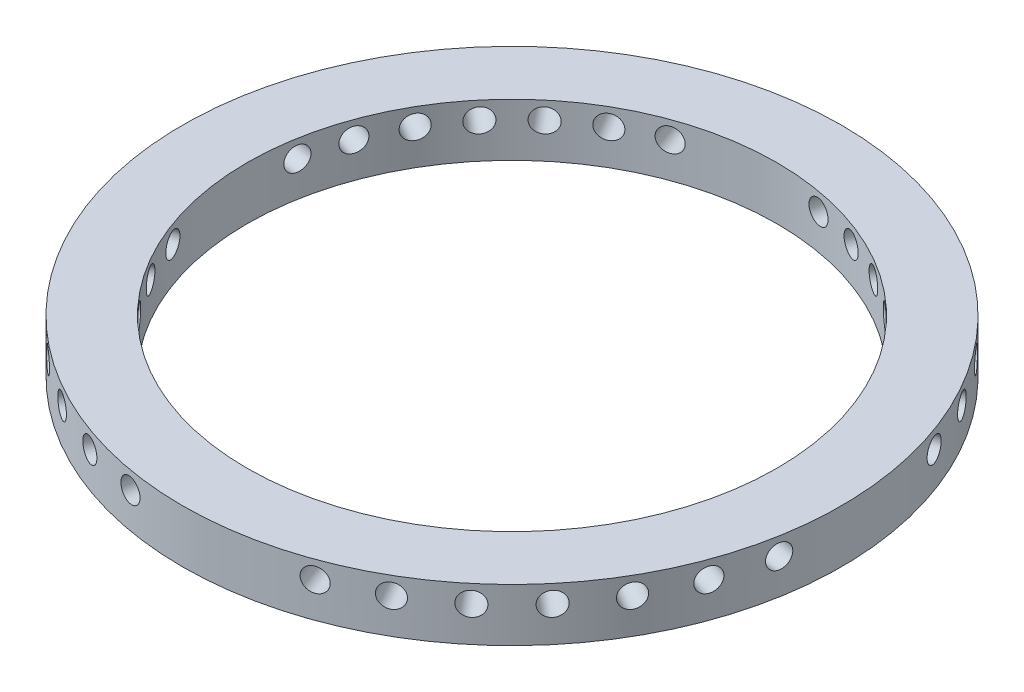
from build123d import *

# Parameters (mm, degrees)
CROQUIS2_R              = 1
CORTAR_EXTRUIR1_DEPTH   = 10
MATRIZC1_COUNT          = 36
CROQUIS3_R              = 1.8
CORTAR_EXTRUIR2_DEPTH   = 3.5
CROQUIS4_R              = 1.8
SALIENTE_EXTRUIR1_DEPTH = 4.5


with BuildPart() as part:
    # Croquis1 → Revolución1 (revolve)
    with BuildSketch(Plane.XY, mode=Mode.PRIVATE) as revoluci_n1_sk:
        Polygon((-22.5, 0), (-28, 0), (-28, 1), (-28, 4.5), (-22.5, 4.5), align=None)
    revolve(revoluci_n1_sk.sketch.rotate(Axis((0, 0, 0), (0, 1, 0)), 270), axis=Axis((0, 0, 0), (0, 1, 0)))

    # Croquis2 → Cortar-Extruir1 (cut)
    with BuildSketch(Plane.ZY.offset(28)):
        with Locations(Location((0, 3, 0), (0, 0, 270))):
            Circle(CROQUIS2_R)
    cortar_extruir1 = extrude(amount=-CORTAR_EXTRUIR1_DEPTH, mode=Mode.SUBTRACT)

    # MatrizC1: Cortar-Extruir1 ×36 about axis
    matrizc1_axis = Axis((0, 0, 0), (0, -1, 0))
    for i in range(1, MATRIZC1_COUNT):
        add(cortar_extruir1.rotate(matrizc1_axis, i * 360 / MATRIZC1_COUNT), mode=Mode.SUBTRACT)

    # Croquis3 → Cortar-Extruir2 (cut)
    with BuildSketch(Plane.XZ):
        with Locations(Location((-25.082532104, 2.430346327, 0), (0, 0, 270))):
            Circle(CROQUIS3_R)
    extrude(amount=-CORTAR_EXTRUIR2_DEPTH, mode=Mode.SUBTRACT)

    # Croquis4 → Saliente-Extruir1 (add)
    # profile 1 of 4: a face of its own
    with BuildSketch(Plane.XZ):
        with BuildLine():
            Line((-1.518133333, 27.958813837), (-1.219928571, 22.466903976))
            ThreePointArc((-1.219928571, 22.466903976), (2.169952078, 22.39511795), (5.51055523, 21.814760623))
            Line((5.51055523, 21.814760623), (6.857579841, 27.147257665))
            ThreePointArc((6.857579841, 27.147257665), (2.700384808, 27.869480115), (-1.518133333, 27.958813837))
        make_face()
    # profile 2 of 4: a face of its own
    with BuildSketch(Plane.XZ):
        with BuildLine():
            Line((27.958813837, 1.518133333), (22.466903976, 1.219928571))
            ThreePointArc((22.466903976, 1.219928571), (22.39511795, -2.169952078), (21.814760623, -5.51055523))
            Line((21.814760623, -5.51055523), (27.147257665, -6.857579841))
            ThreePointArc((27.147257665, -6.857579841), (27.869480115, -2.700384808), (27.958813837, 1.518133333))
        make_face()
    # profile 3 of 4: a face of its own
    with BuildSketch(Plane.XZ):
        with BuildLine():
            Line((1.518133333, -27.958813837), (1.219928571, -22.466903976))
            ThreePointArc((1.219928571, -22.466903976), (-2.169952078, -22.39511795), (-5.51055523, -21.814760623))
            Line((-5.51055523, -21.814760623), (-6.857579841, -27.147257665))
            ThreePointArc((-6.857579841, -27.147257665), (-2.700384808, -27.869480115), (1.518133333, -27.958813837))
        make_face()
    # profile 4 of 4: a face of its own
    with BuildSketch(Plane.XZ):
        with BuildLine():
            Line((-27.958813837, -1.518133333), (-22.466903976, -1.219928571))
            ThreePointArc((-22.466903976, -1.219928571), (-22.39511795, 2.169952078), (-21.814760623, 5.51055523))
            Line((-21.814760623, 5.51055523), (-27.147257665, 6.857579841))
            ThreePointArc((-27.147257665, 6.857579841), (-27.869480115, 2.700384808), (-27.958813837, -1.518133333))
        make_face()
        with Locations(Location((-25.082532104, 2.430346327, 0), (0, 0, 270))):
            Circle(CROQUIS4_R, mode=Mode.SUBTRACT)
    extrude(amount=-SALIENTE_EXTRUIR1_DEPTH)


solid = part.part
